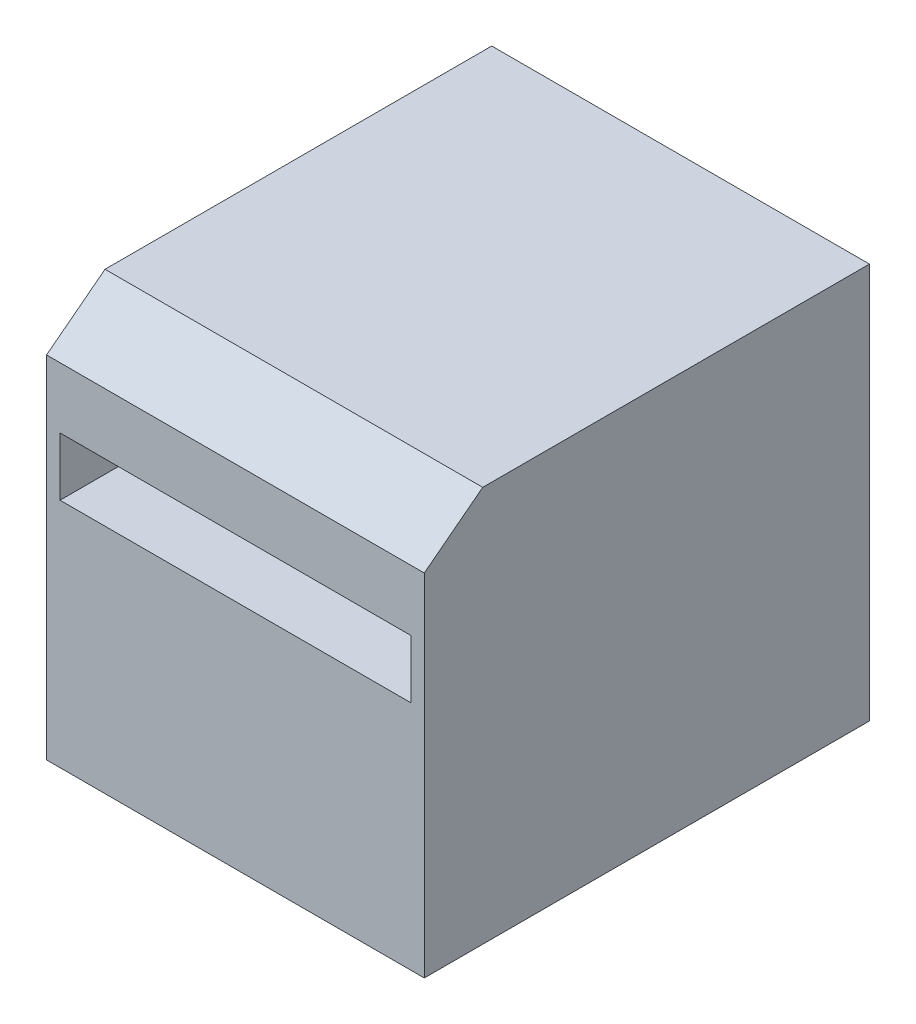
from build123d import *

# Parameters (mm, degrees)
BOSS_EXTRUDE1_DEPTH = 84
SKETCH2_W           = 78
SKETCH2_H           = 12.96225643
CUT_EXTRUDE1_DEPTH  = 157.847059265


with BuildPart() as part:
    # Sketch1 → Boss-Extrude1 (new body)
    with BuildSketch(Plane(origin=(0, 0, 0), x_dir=(0, 0, -1), z_dir=(1, 0, 0))):
        Polygon((0, 0), (0, 78), (13, 88), (99, 88), (99, 0), align=None)
    extrude(amount=BOSS_EXTRUDE1_DEPTH)

    # Sketch2 → Cut-Extrude1 (cut, through all)
    with BuildSketch(Plane(origin=(0, 0, -99), x_dir=(-1, 0, 0), z_dir=(0, 0, -1))):
        with Locations((-42, 58)):
            Rectangle(SKETCH2_W, SKETCH2_H)
    extrude(amount=-CUT_EXTRUDE1_DEPTH, mode=Mode.SUBTRACT)


solid = part.part
